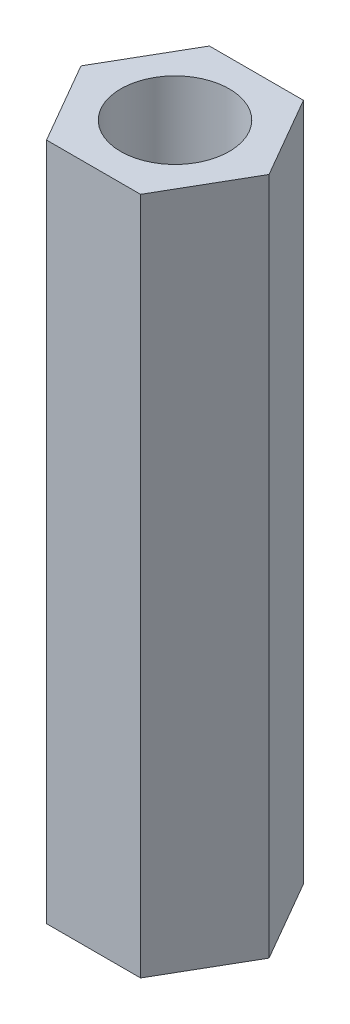
from build123d import *

# Parameters (mm, degrees)
SKETCH_1_R      = 2
EXTRUDE_1_DEPTH = 25


with BuildPart() as part:
    # 草图1 → 凸台-拉伸1 (new body)
    with BuildSketch(Plane(origin=(0, 0, 0), x_dir=(1, 0, 0), z_dir=(0, 1, 0))):
        Polygon((-3.464101615, 0), (-1.732050808, -3), (1.732050808, -3), (3.464101615, 0), (1.732050808, 3), (-1.732050808, 3), align=None)
        with Locations(Location((0, 0, 0), (0, 0, 270))):
            Circle(SKETCH_1_R, mode=Mode.SUBTRACT)
    extrude(amount=EXTRUDE_1_DEPTH)


solid = part.part
